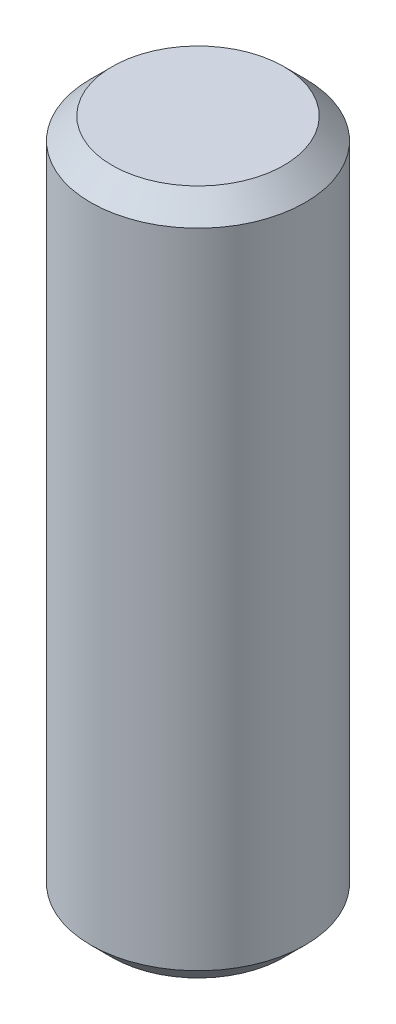
from build123d import *

# Parameters (mm, degrees)
SKETCH1_R           = 2.5
BOSS_EXTRUDE1_DEPTH = 16
CHAMFER1_SIZE       = 0.5


with BuildPart() as part:
    # Sketch1 → Boss-Extrude1 (new body)
    with BuildSketch(Plane(origin=(0, 0, 0), x_dir=(1, 0, 0), z_dir=(0, 1, 0))):
        with Locations(Location((0, 0, 0), (0, 0, 270))):
            Circle(SKETCH1_R)
    extrude(amount=BOSS_EXTRUDE1_DEPTH)

    # Chamfer1
    chamfer1_edges = [part.edges().sort_by_distance(p)[0] for p in [
        (0, 0, -2.5),
        (0, 16, -2.5),
    ]]
    chamfer(chamfer1_edges, length=CHAMFER1_SIZE)


solid = part.part
